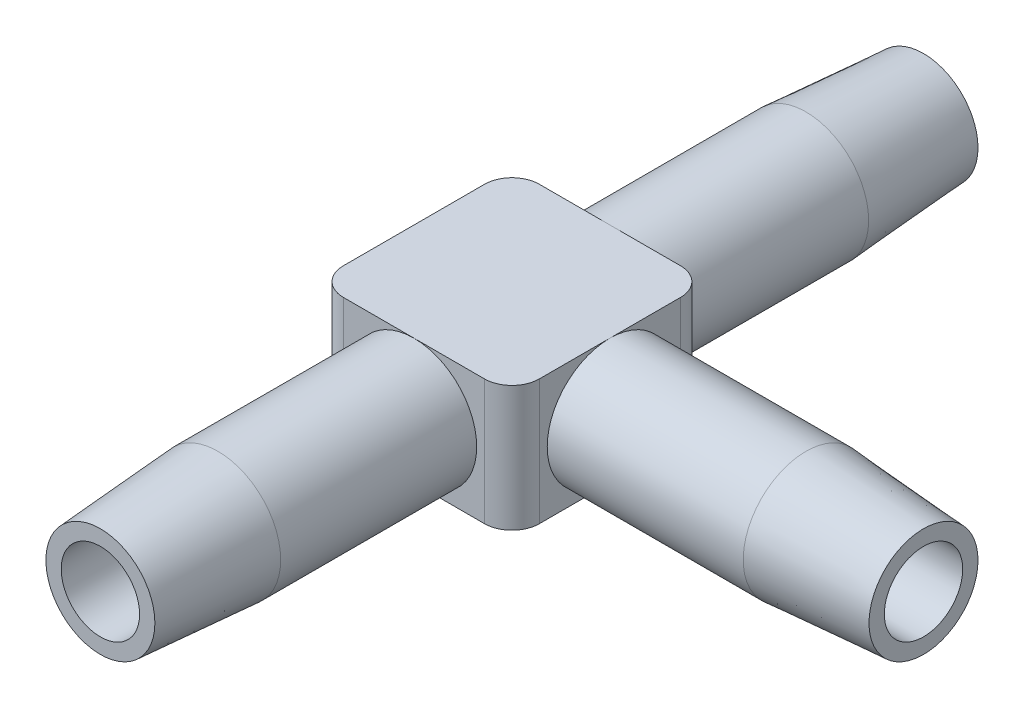
from build123d import *

# Parameters (mm, degrees)
SKETCH1_W               = 10
SKETCH1_H               = 10
BOSS_EXTRUDE1_DEPTH     = 6.4
SKETCH2_R               = 3.2
BOSS_EXTRUDE2_DEPTH     = 10
SKETCH4_R               = 3.2
BOSS_EXTRUDE3_DEPTH     = 10
SKETCH8_R               = 3.2
BOSS_EXTRUDE4_DEPTH     = 6
BOSS_EXTRUDE4_TAPER     = 4
SKETCH10_R              = 3.2
BOSS_EXTRUDE5_DEPTH     = 6
BOSS_EXTRUDE5_TAPER     = 4
FILLET1_R               = 1.4
SKETCH11_R              = 2
CUT_EXTRUDE5_DEPTH      = 48.391560488
CUT_EXTRUDE6_REACH      = 36.029
CUT_EXTRUDE6_END_RADIUS = 2
SKETCH9_R               = 2


with BuildPart() as part:
    # Sketch1 → Boss-Extrude1 (new body)
    with BuildSketch(Plane(origin=(0, 0, 0), x_dir=(1, 0, 0), z_dir=(0, 1, 0))):
        Rectangle(SKETCH1_W, SKETCH1_H)
    extrude(amount=BOSS_EXTRUDE1_DEPTH)

    # Sketch2 → Boss-Extrude2 (add)
    with BuildSketch(Plane.XY.offset(5)):
        with Locations(Location((0, 3.2, 0), (0, 0, 270))):
            Circle(SKETCH2_R)
    boss_extrude2 = extrude(amount=BOSS_EXTRUDE2_DEPTH)

    # Sketch4 → Boss-Extrude3 (add)
    with BuildSketch(Plane(origin=(5, 0, 0), x_dir=(0, 0, -1), z_dir=(1, 0, 0))):
        with Locations(Location((0, 3.2, 0), (0, 0, 270))):
            Circle(SKETCH4_R)
    extrude(amount=BOSS_EXTRUDE3_DEPTH)

    # Sketch8 → Boss-Extrude4 (add)
    with BuildSketch(Plane(origin=(15, 0, 0), x_dir=(0, 0, -1), z_dir=(1, 0, 0))):
        with Locations(Location((0, 3.2, 0), (0, 0, 270))):
            Circle(SKETCH8_R)
    extrude(amount=BOSS_EXTRUDE4_DEPTH, taper=BOSS_EXTRUDE4_TAPER)

    # Sketch10 → Boss-Extrude5 (add)
    with BuildSketch(Plane.XY.offset(15)):
        with Locations(Location((0, 3.2, 0), (0, 0, 270))):
            Circle(SKETCH10_R)
    boss_extrude5 = extrude(amount=BOSS_EXTRUDE5_DEPTH, taper=BOSS_EXTRUDE5_TAPER)

    # Mirror2: Boss-Extrude2, Boss-Extrude5 across plane
    add(boss_extrude2.mirror(Plane.XY))
    add(boss_extrude5.mirror(Plane.XY))

    # Fillet1
    fillet1_edges = [part.edges().sort_by_distance(p)[0] for p in [
        (-5, 3.2, -5),
        (5, 3.2, -5),
        (5, 3.2, 5),
        (-5, 3.2, 5),
    ]]
    fillet(fillet1_edges, radius=FILLET1_R)

    # Sketch11 → Cut-Extrude5 (cut, through all)
    with BuildSketch(Plane.XY.offset(21)):
        with Locations((0, 3.2)):
            Circle(SKETCH11_R)
    extrude(amount=-CUT_EXTRUDE5_DEPTH, mode=Mode.SUBTRACT)

    # Cut-Extrude6: up to this cylinder (the profile starts outside it)
    cut_extrude6_end = Plane(origin=(0, 3.2, 0), z_dir=(0, 0, 1)) * Cylinder(CUT_EXTRUDE6_END_RADIUS, 77.058, mode=Mode.PRIVATE)
    # Sketch9 → Cut-Extrude6 (cut, up to the surface)
    with BuildSketch(Plane(origin=(21, 0, 0), x_dir=(0, 0, -1), z_dir=(1, 0, 0)), mode=Mode.PRIVATE) as cut_extrude6_sk1:
        with Locations((0, 3.2)):
            Circle(SKETCH9_R)
    cut_extrude6_tool1 = extrude(cut_extrude6_sk1.sketch, amount=-CUT_EXTRUDE6_REACH, mode=Mode.PRIVATE) - cut_extrude6_end
    add(cut_extrude6_tool1.solids().sort_by_distance((21, 3.2, 0))[0], mode=Mode.SUBTRACT)


solid = part.part
